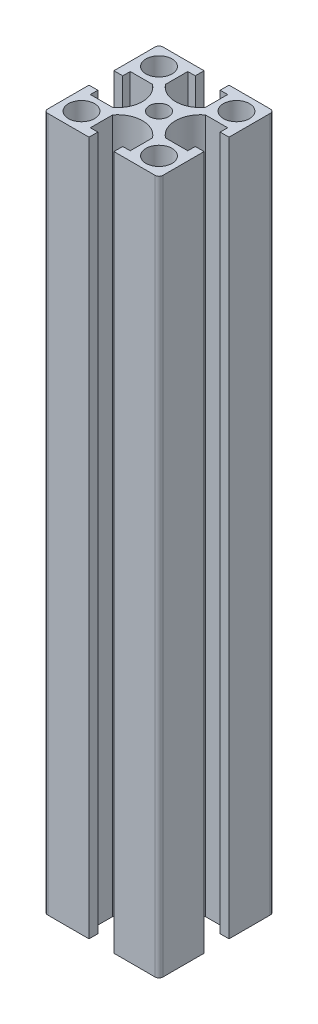
from build123d import *

# Parameters (mm, degrees)
SKETCH_1_R      = 2.5
SKETCH_1_R_2    = 3.4
EXTRUDE_1_DEPTH = 181


with BuildPart() as part:
    # 草图1 → 凸台-拉伸1 (new body)
    with BuildSketch(Plane(origin=(0, 0, 0), x_dir=(1, 0, 0), z_dir=(0, 1, 0))):
        with BuildLine():
            Line((-14, 15), (-3.25, 15))
            Line((-3.25, 15), (-3.25, 12.7))
            Line((-3.25, 12.7), (-5.2, 12.7))
            Line((-5.2, 12.7), (-5.2, 6.9))
            ThreePointArc((-5.2, 6.9), (0, 4.3), (5.2, 6.9))
            Line((5.2, 6.9), (5.2, 12.7))
            Line((5.2, 12.7), (3.25, 12.7))
            Line((3.25, 12.7), (3.25, 15))
            Line((3.25, 15), (14, 15))
            ThreePointArc((14, 15), (14.707106781, 14.707106781), (15, 14))
            Line((15, 14), (15, 3.25))
            Line((15, 3.25), (12.7, 3.25))
            Line((12.7, 3.25), (12.7, 5.2))
            Line((12.7, 5.2), (6.9, 5.2))
            ThreePointArc((6.9, 5.2), (4.3, 0), (6.9, -5.2))
            Line((6.9, -5.2), (12.7, -5.2))
            Line((12.7, -5.2), (12.7, -3.25))
            Line((12.7, -3.25), (15, -3.25))
            Line((15, -3.25), (15, -14))
            ThreePointArc((15, -14), (14.707106781, -14.707106781), (14, -15))
            Line((14, -15), (3.25, -15))
            Line((3.25, -15), (3.25, -12.7))
            Line((3.25, -12.7), (5.2, -12.7))
            Line((5.2, -12.7), (5.2, -6.9))
            ThreePointArc((5.2, -6.9), (0, -4.3), (-5.2, -6.9))
            Line((-5.2, -6.9), (-5.2, -12.7))
            Line((-5.2, -12.7), (-3.25, -12.7))
            Line((-3.25, -12.7), (-3.25, -15))
            Line((-3.25, -15), (-14, -15))
            ThreePointArc((-14, -15), (-14.707106781, -14.707106781), (-15, -14))
            Line((-15, -14), (-15, -3.25))
            Line((-15, -3.25), (-12.7, -3.25))
            Line((-12.7, -3.25), (-12.7, -5.2))
            Line((-12.7, -5.2), (-6.9, -5.2))
            ThreePointArc((-6.9, -5.2), (-4.3, 0), (-6.9, 5.2))
            Line((-6.9, 5.2), (-12.7, 5.2))
            Line((-12.7, 5.2), (-12.7, 3.25))
            Line((-12.7, 3.25), (-15, 3.25))
            Line((-15, 3.25), (-15, 14))
            ThreePointArc((-15, 14), (-14.707106781, 14.707106781), (-14, 15))
        make_face()
        with Locations(Location((0, 0, 0), (0, 0, 270))):
            Circle(SKETCH_1_R, mode=Mode.SUBTRACT)
        with Locations(Location((-10.1, 10.1, 0), (0, 0, 270))):
            Circle(SKETCH_1_R_2, mode=Mode.SUBTRACT)
        with Locations(Location((10.1, 10.1, 0), (0, 0, 90))):
            Circle(SKETCH_1_R_2, mode=Mode.SUBTRACT)
        with Locations(Location((10.1, -10.1, 0), (0, 0, 270))):
            Circle(SKETCH_1_R_2, mode=Mode.SUBTRACT)
        with Locations(Location((-10.1, -10.1, 0), (0, 0, 90))):
            Circle(SKETCH_1_R_2, mode=Mode.SUBTRACT)
    extrude(amount=EXTRUDE_1_DEPTH)


solid = part.part
